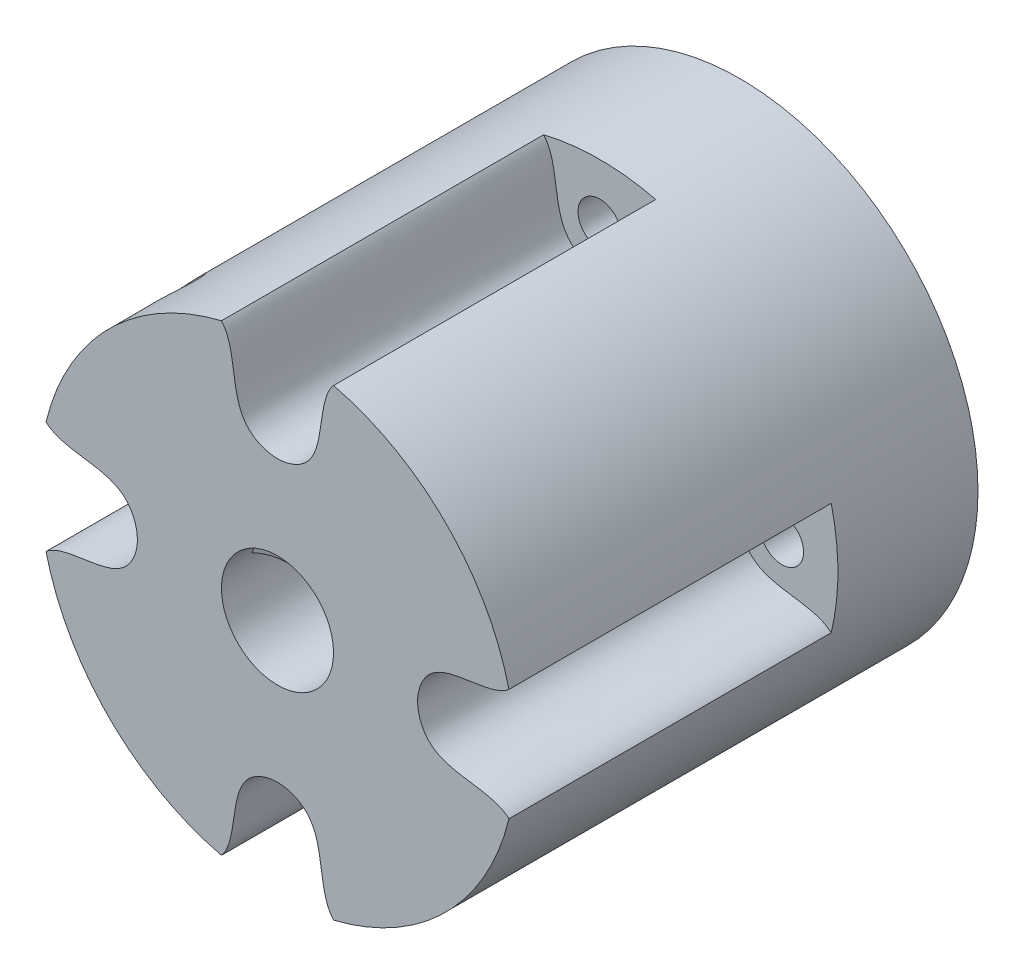
from build123d import *

# Parameters (mm, degrees)
SKETCH1_R           = 17
BOSS_EXTRUDE1_DEPTH = 10
SKETCH2_R           = 1.55
CUT_EXTRUDE1_DEPTH  = 27.038433133
BOSS_EXTRUDE3_DEPTH = 23
SKETCH4_R           = 4
CUT_EXTRUDE2_DEPTH  = 23
SKETCH7_R           = 1.55
CUT_EXTRUDE3_DEPTH  = 15
CUT_EXTRUDE6_DEPTH  = 7


with BuildPart() as part:
    # Sketch1 → Boss-Extrude1 (new body)
    with BuildSketch(Plane.XY):
        Circle(SKETCH1_R)
    extrude(amount=BOSS_EXTRUDE1_DEPTH)

    # Sketch2 → Cut-Extrude1 (cut, through all)
    with BuildSketch(Plane.XY.offset(10)):
        with Locations((13, 0)):
            Circle(SKETCH2_R)
        with Locations((0, -13)):
            Circle(SKETCH2_R)
        with Locations((-13, 0)):
            Circle(SKETCH2_R)
        with Locations((0, 13)):
            Circle(SKETCH2_R)
    extrude(amount=-CUT_EXTRUDE1_DEPTH, mode=Mode.SUBTRACT)

    # Sketch3 → Boss-Extrude3 (add)
    with BuildSketch(Plane.XY.offset(10)):
        with BuildLine():
            ThreePointArc((16.522711642, 4), (12.02081528, 12.02081528), (4, 16.522711642))
            add(Edge.make_bspline(
                [(4, 16.522711642), (2.816233041, 15.179097537), (3.696027617, 11.190043266), (0, 9.66895733), (-3.696027617, 11.190043266), (-2.816233041, 15.179097537), (-4, 16.522711642)],
                knots=[0, 0, 0, 0, 0.360911498, 0.5, 0.639088502, 1, 1, 1, 1], degree=3))
            ThreePointArc((-4, 16.522711642), (-12.02081528, 12.02081528), (-16.522711642, 4))
            add(Edge.make_bspline(
                [(-16.522711642, 4), (-15.179097537, 2.816233041), (-11.190043266, 3.696027617), (-9.66895733, 0), (-11.190043266, -3.696027617), (-15.179097537, -2.816233041), (-16.522711642, -4)],
                knots=[0, 0, 0, 0, 0.360911498, 0.5, 0.639088502, 1, 1, 1, 1], degree=3))
            ThreePointArc((-16.522711642, -4), (-12.02081528, -12.02081528), (-4, -16.522711642))
            add(Edge.make_bspline(
                [(-4, -16.522711642), (-2.816233041, -15.179097537), (-3.696027617, -11.190043266), (0, -9.66895733), (3.696027617, -11.190043266), (2.816233041, -15.179097537), (4, -16.522711642)],
                knots=[0, 0, 0, 0, 0.360911498, 0.5, 0.639088502, 1, 1, 1, 1], degree=3))
            ThreePointArc((4, -16.522711642), (12.02081528, -12.02081528), (16.522711642, -4))
            add(Edge.make_bspline(
                [(16.522711642, -4), (15.179097537, -2.816233041), (11.190043266, -3.696027617), (9.66895733, 0), (11.190043266, 3.696027617), (15.179097537, 2.816233041), (16.522711642, 4)],
                knots=[0, 0, 0, 0, 0.360911498, 0.5, 0.639088502, 1, 1, 1, 1], degree=3))
        make_face()
    extrude(amount=BOSS_EXTRUDE3_DEPTH)

    # Sketch4 → Cut-Extrude2 (cut)
    with BuildSketch(Plane.XY.offset(33)):
        Circle(SKETCH4_R)
    extrude(amount=-CUT_EXTRUDE2_DEPTH, mode=Mode.SUBTRACT)

    # Sketch7 → Cut-Extrude3 (cut)
    with BuildSketch(Plane(origin=(-12.02081528, 12.02081528, 0), x_dir=(0, 0, -1), z_dir=(-0.7071067811865464, 0.7071067811865488, 0))):
        with Locations(Location((-28, 0, 0), (0, 0, 90))):
            Circle(SKETCH7_R)
    extrude(amount=-CUT_EXTRUDE3_DEPTH, mode=Mode.SUBTRACT)

    # Sketch11 → Cut-Extrude6 (cut)
    with BuildSketch(Plane(origin=(0, 0, 0), x_dir=(0, 0, -1), z_dir=(-0.7071067811865464, 0.7071067811865488, 0))):
        Polygon((-28, 3.5), (-31.031088913, 1.75), (-31.031088913, -1.75), (-28, -3.5), (-24.968911087, -1.75), (-24.968911087, 1.75), align=None)
    extrude(amount=CUT_EXTRUDE6_DEPTH, mode=Mode.SUBTRACT)


solid = part.part
